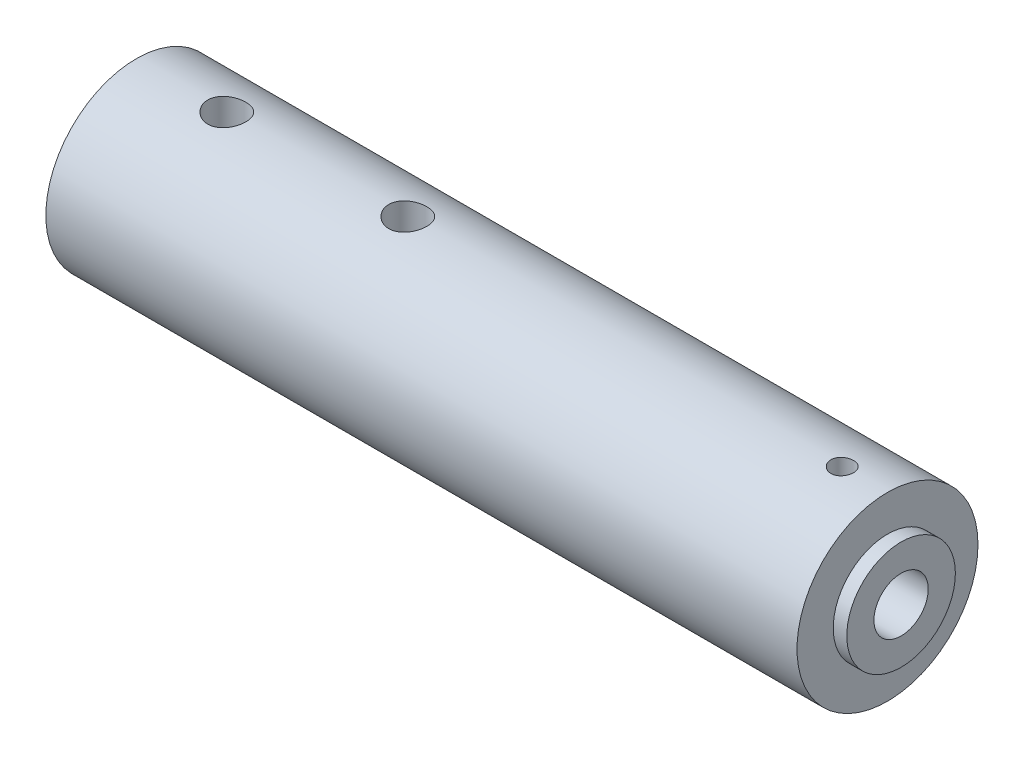
from build123d import *

# Parameters (mm, degrees)
ESQUISSE1_R                = 10
BOSS_EXTRU_1_DEPTH         = 83
ESQUISSE2_R                = 6
BOSS_EXTRU_2_DEPTH         = 1.5
ESQUISSE5_R                = 3
ENL_V_MAT_EXTRU_2_DEPTH    = 25
ESQUISSE9_W                = 1.25
ESQUISSE9_H                = 10
ESQUISSE18_W               = 2.1
ESQUISSE18_H               = 10
TROU_TARAUD_M53_AT_2_COUNT = 2
TROU_TARAUD_M53_AT_2_PITCH = 20
ESQUISSE19_R               = 2.5
ENL_V_MAT_EXTRU_3_DEPTH    = 86.675259097


with BuildPart() as part:
    # Esquisse1 → Boss.-Extru.1 (new body)
    with BuildSketch(Plane(origin=(0, 0, 0), x_dir=(0, 0, -1), z_dir=(1, 0, 0))):
        Circle(ESQUISSE1_R)
    extrude(amount=BOSS_EXTRU_1_DEPTH)

    # Esquisse2 → Boss.-Extru.2 (add)
    with BuildSketch(Plane(origin=(83, 0, 0), x_dir=(0, 0, -1), z_dir=(1, 0, 0))):
        Circle(ESQUISSE2_R)
    extrude(amount=BOSS_EXTRU_2_DEPTH)

    # Esquisse5 → Enlèv. mat.-Extru.2 (cut)
    with BuildSketch(Plane(origin=(84.5, 0, 0), x_dir=(0, 0, -1), z_dir=(1, 0, 0))):
        Circle(ESQUISSE5_R)
    extrude(amount=-ENL_V_MAT_EXTRU_2_DEPTH, mode=Mode.SUBTRACT)

    # Esquisse9 → Trou taraudé M31 (revolve, cut)
    with BuildSketch(Plane(origin=(78, 0, 0), x_dir=(0, 0, -1), z_dir=(1, 0, 0))):
        with Locations((0.625, 5)):
            Rectangle(ESQUISSE9_W, ESQUISSE9_H)
    revolve(axis=Axis((78, -6.35, 0), (0, 1, 0)), mode=Mode.SUBTRACT)

    # Esquisse18 → Trou taraudé M53 (revolve, cut)
    with BuildSketch(Plane(origin=(10, 0, 0), x_dir=(0, 0, -1), z_dir=(1, 0, 0))):
        with Locations((1.05, 5)):
            Rectangle(ESQUISSE18_W, ESQUISSE18_H)
    trou_taraud_m53 = revolve(axis=Axis((10, -6.35, 0), (0, 1, 0)), mode=Mode.SUBTRACT)

    # Trou taraudé M53 at 2: Trou taraudé M53 ×2
    with Locations(*[(i * TROU_TARAUD_M53_AT_2_PITCH, 0, 0) for i in range(1, TROU_TARAUD_M53_AT_2_COUNT)]):
        add(trou_taraud_m53, mode=Mode.SUBTRACT)

    # Esquisse19 → Enlèv. mat.-Extru.3 (cut, through all)
    with BuildSketch(Plane(origin=(0, 0, 0), x_dir=(1, 0, 0), z_dir=(0, 1, 0))):
        with Locations(Location((10, 0, 0), (0, 0, 270))):
            Circle(ESQUISSE19_R)
        with Locations(Location((30, 0, 0), (0, 0, 270))):
            Circle(ESQUISSE19_R)
    extrude(amount=-ENL_V_MAT_EXTRU_3_DEPTH, mode=Mode.SUBTRACT)


solid = part.part
